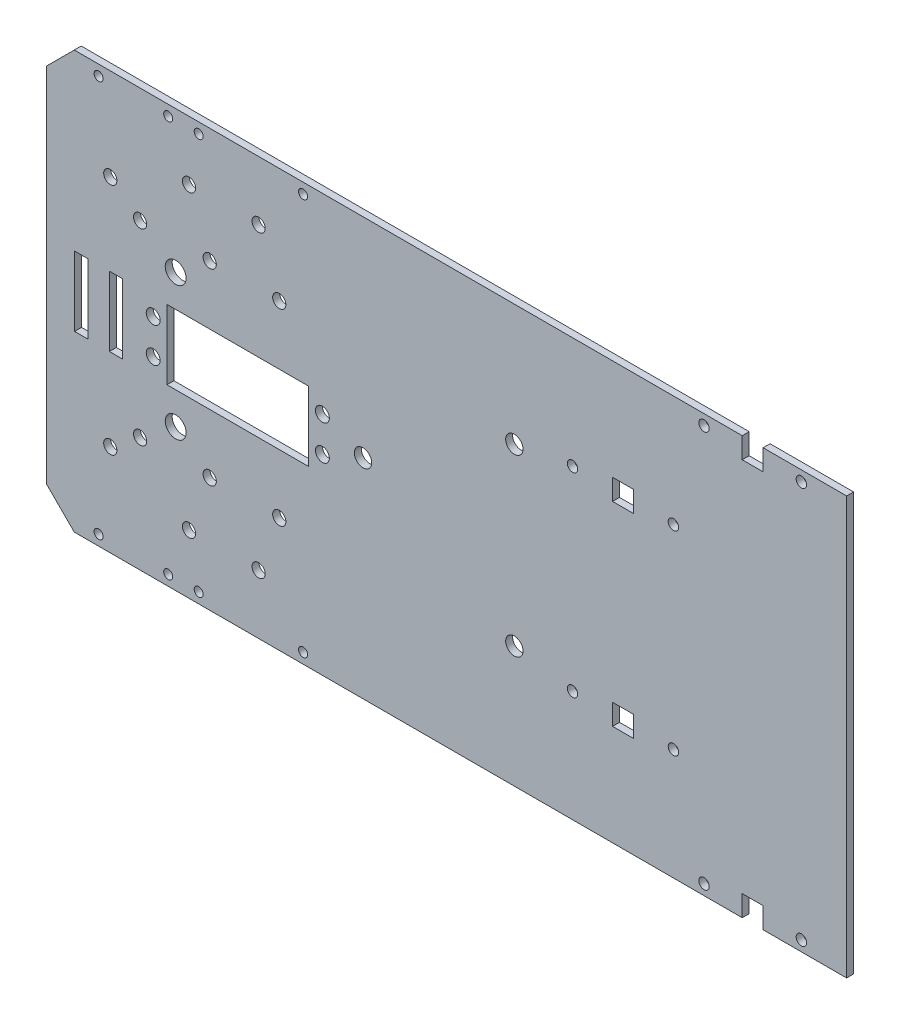
from build123d import *

# Parameters (mm, degrees)
SKETCH_5_W           = 230
SKETCH_5_H           = 120
EXTRUDE_2_DEPTH      = 2
SKETCH_6_R           = 2.5
CUT_EXTRUDE_3_DEPTH  = 130.726635661
SKETCH_7_R           = 1.5
SKETCH_7_W           = 6
SKETCH_7_H           = 6
CUT_EXTRUDE_4_DEPTH  = 130.726635661
SKETCH_8_R           = 1.5
SKETCH_8_W           = 6
SKETCH_8_H           = 6
CUT_EXTRUDE_5_DEPTH  = 130.726635661
SKETCH_9_R           = 2
SKETCH_9_W           = 40.7
SKETCH_9_H           = 20
CUT_EXTRUDE_6_DEPTH  = 130.726635661
SKETCH_10_R          = 1.3
CUT_EXTRUDE_7_DEPTH  = 130.726635661
SKETCH_11_R          = 1.3
CUT_EXTRUDE_8_DEPTH  = 130.726635661
SKETCH_12_R          = 1.9
CUT_EXTRUDE_9_DEPTH  = 130.726635661
SKETCH_13_W          = 3.8
SKETCH_13_H          = 20
CUT_EXTRUDE_10_DEPTH = 130.726635661
SKETCH_14_R          = 1.9
CUT_EXTRUDE_11_DEPTH = 130.726635661
SKETCH_17_R          = 3
CUT_EXTRUDE_12_DEPTH = 130.726635661
CHAMFER_1_SIZE       = 8


with BuildPart() as part:
    # 草图5 → 凸台-拉伸2 (new body)
    with BuildSketch(Plane.XY):
        Rectangle(SKETCH_5_W, SKETCH_5_H)
    extrude(amount=EXTRUDE_2_DEPTH)

    # 草图6 → 切除-拉伸3 (cut, through all)
    with BuildSketch(Plane.XY.offset(2)):
        with Locations((-24, 0)):
            Circle(SKETCH_6_R)
        with Locations((19.5, 25.11473671)):
            Circle(SKETCH_6_R)
        with Locations((19.5, -25.11473671)):
            Circle(SKETCH_6_R)
    extrude(amount=-CUT_EXTRUDE_3_DEPTH, mode=Mode.SUBTRACT)

    # 草图7 → 切除-拉伸4 (cut, through all)
    with BuildSketch(Plane.XY.offset(2)):
        with Locations((74, 57)):
            Circle(SKETCH_7_R)
        with Locations(Location((102, 57, 0), (0, 0, 180))):
            Circle(SKETCH_7_R)
        with Locations((102, -57)):
            Circle(SKETCH_7_R)
        with Locations(Location((74, -57, 0), (0, 0, 180))):
            Circle(SKETCH_7_R)
        with Locations((88, 57)):
            Rectangle(SKETCH_7_W, SKETCH_7_H)
        with Locations((88, -57)):
            Rectangle(SKETCH_7_W, SKETCH_7_H)
    extrude(amount=-CUT_EXTRUDE_4_DEPTH, mode=Mode.SUBTRACT)

    # 草图8 → 切除-拉伸5 (cut, through all)
    with BuildSketch(Plane.XY.offset(2)):
        with Locations((36.22, 28)):
            Circle(SKETCH_8_R)
        with Locations(Location((65.22, 28, 0), (0, 0, 180))):
            Circle(SKETCH_8_R)
        with Locations((65.22, -28)):
            Circle(SKETCH_8_R)
        with Locations(Location((36.22, -28, 0), (0, 0, 180))):
            Circle(SKETCH_8_R)
        with Locations((50.72, 28)):
            Rectangle(SKETCH_8_W, SKETCH_8_H)
        with Locations((50.72, -28)):
            Rectangle(SKETCH_8_W, SKETCH_8_H)
    extrude(amount=-CUT_EXTRUDE_5_DEPTH, mode=Mode.SUBTRACT)

    # 草图9 → 切除-拉伸6 (cut, through all)
    with BuildSketch(Plane.XY.offset(2)):
        with Locations((-84.315, 5)):
            Circle(SKETCH_9_R)
        with Locations(Location((-84.315, -5, 0), (0, 0, 180))):
            Circle(SKETCH_9_R)
        with Locations((-35.685, -5)):
            Circle(SKETCH_9_R)
        with Locations(Location((-35.685, 5, 0), (0, 0, 180))):
            Circle(SKETCH_9_R)
        with Locations((-60, 0)):
            Rectangle(SKETCH_9_W, SKETCH_9_H)
    extrude(amount=-CUT_EXTRUDE_6_DEPTH, mode=Mode.SUBTRACT)

    # 草图10 → 切除-拉伸7 (cut, through all)
    with BuildSketch(Plane.XY.offset(2)):
        with Locations((-41.227442559, 57)):
            Circle(SKETCH_10_R)
        with Locations(Location((-41.227442559, -57, 0), (0, 0, 180))):
            Circle(SKETCH_10_R)
        with Locations((-71.227442559, 57)):
            Circle(SKETCH_10_R)
        with Locations(Location((-71.227442559, -57, 0), (0, 0, 180))):
            Circle(SKETCH_10_R)
    extrude(amount=-CUT_EXTRUDE_7_DEPTH, mode=Mode.SUBTRACT)

    # 草图11 → 切除-拉伸8 (cut, through all)
    with BuildSketch(Plane.XY.offset(2)):
        with Locations((-100, 57)):
            Circle(SKETCH_11_R)
        with Locations((-80, 57)):
            Circle(SKETCH_11_R)
        with Locations(Location((-80, -57, 0), (0, 0, 180))):
            Circle(SKETCH_11_R)
        with Locations(Location((-100, -57, 0), (0, 0, 180))):
            Circle(SKETCH_11_R)
    extrude(amount=-CUT_EXTRUDE_8_DEPTH, mode=Mode.SUBTRACT)

    # 草图12 → 切除-拉伸9 (cut, through all)
    with BuildSketch(Plane.XY.offset(2)):
        with Locations((-48.073915411, 27)):
            Circle(SKETCH_12_R)
        with Locations(Location((-54.014113812, -43, 0), (0, 0, 180))):
            Circle(SKETCH_12_R)
        with Locations((-68.073915411, 27)):
            Circle(SKETCH_12_R)
        with Locations((-74.014113812, 43)):
            Circle(SKETCH_12_R)
        with Locations((-88.073915411, 27)):
            Circle(SKETCH_12_R)
        with Locations((-54.014113812, 43)):
            Circle(SKETCH_12_R)
        with Locations(Location((-88.073915411, -27, 0), (0, 0, 180))):
            Circle(SKETCH_12_R)
        with Locations(Location((-74.014113812, -43, 0), (0, 0, 180))):
            Circle(SKETCH_12_R)
        with Locations(Location((-68.073915411, -27, 0), (0, 0, 180))):
            Circle(SKETCH_12_R)
        with Locations(Location((-48.073915411, -27, 0), (0, 0, 180))):
            Circle(SKETCH_12_R)
    extrude(amount=-CUT_EXTRUDE_9_DEPTH, mode=Mode.SUBTRACT)

    # 草图13 → 切除-拉伸10 (cut, through all)
    with BuildSketch(Plane.XY.offset(2)):
        with Locations((-95, 0)):
            Rectangle(SKETCH_13_W, SKETCH_13_H)
        with Locations((-105, 0)):
            Rectangle(SKETCH_13_W, SKETCH_13_H)
    extrude(amount=-CUT_EXTRUDE_10_DEPTH, mode=Mode.SUBTRACT)

    # 草图14 → 切除-拉伸11 (cut, through all)
    with BuildSketch(Plane.XY.offset(2)):
        with Locations((-96.644922827, 33.589628644)):
            Circle(SKETCH_14_R)
        with Locations(Location((-96.644922827, -33.589628644, 0), (0, 0, 180))):
            Circle(SKETCH_14_R)
    extrude(amount=-CUT_EXTRUDE_11_DEPTH, mode=Mode.SUBTRACT)

    # 草图17 → 切除-拉伸12 (cut, through all)
    with BuildSketch(Plane.XY.offset(2)):
        with Locations((-77.855262933, 19.238416103)):
            Circle(SKETCH_17_R)
        with Locations(Location((-77.855262933, -19.238416103, 0), (0, 0, 180))):
            Circle(SKETCH_17_R)
    extrude(amount=-CUT_EXTRUDE_12_DEPTH, mode=Mode.SUBTRACT)

    # 倒角1
    chamfer_1_edges = [part.edges().sort_by_distance(p)[0] for p in [
        (-115, -60, 1),
        (-115, 60, 1),
    ]]
    chamfer(chamfer_1_edges, length=CHAMFER_1_SIZE)


solid = part.part
